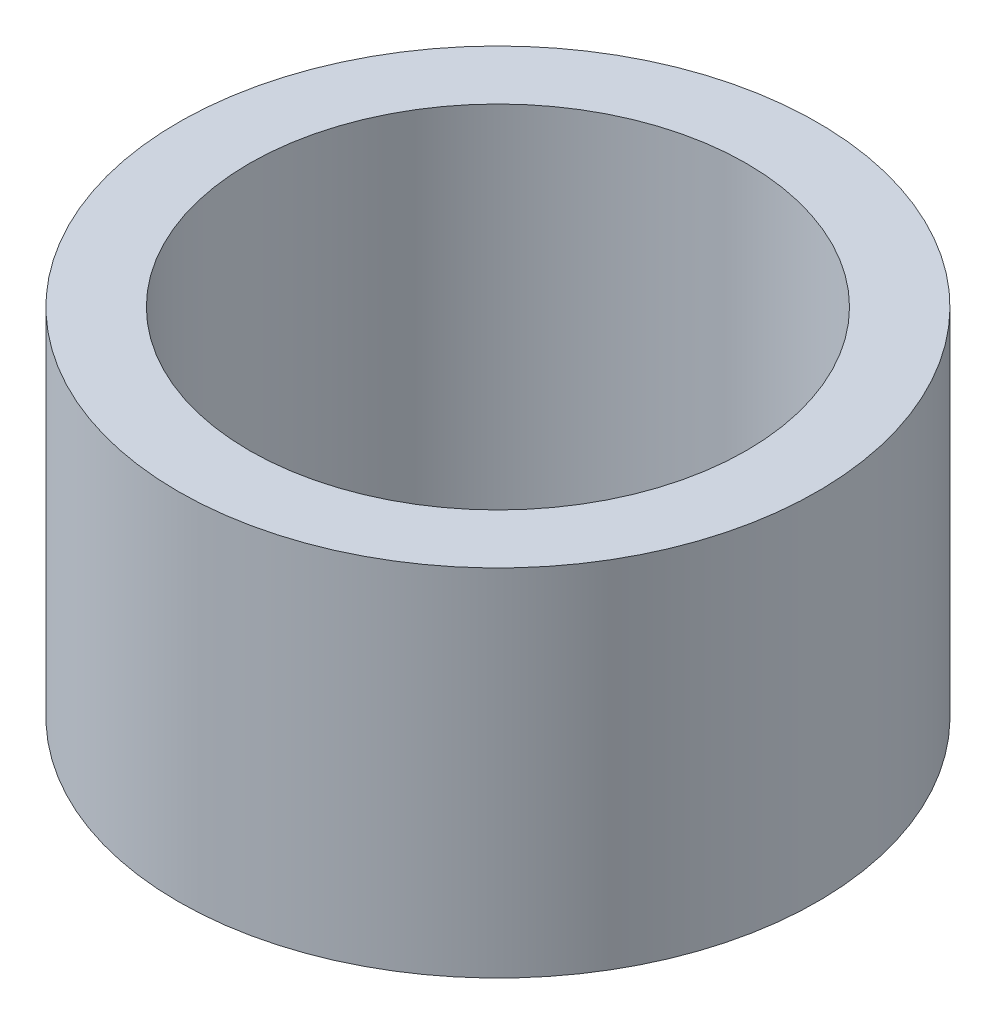
from build123d import *

# Parameters (mm, degrees)
SKETCH1_R           = 22.5
SKETCH1_R_2         = 17.5
BOSS_EXTRUDE1_DEPTH = 25


with BuildPart() as part:
    # Sketch1 → Boss-Extrude1 (new body)
    with BuildSketch(Plane(origin=(0, 0, 0), x_dir=(1, 0, 0), z_dir=(0, 1, 0))):
        with Locations(Location((0, 0, 0), (0, 0, 270))):
            Circle(SKETCH1_R)
        with Locations(Location((0, 0, 0), (0, 0, 270))):
            Circle(SKETCH1_R_2, mode=Mode.SUBTRACT)
    extrude(amount=BOSS_EXTRUDE1_DEPTH)


solid = part.part
